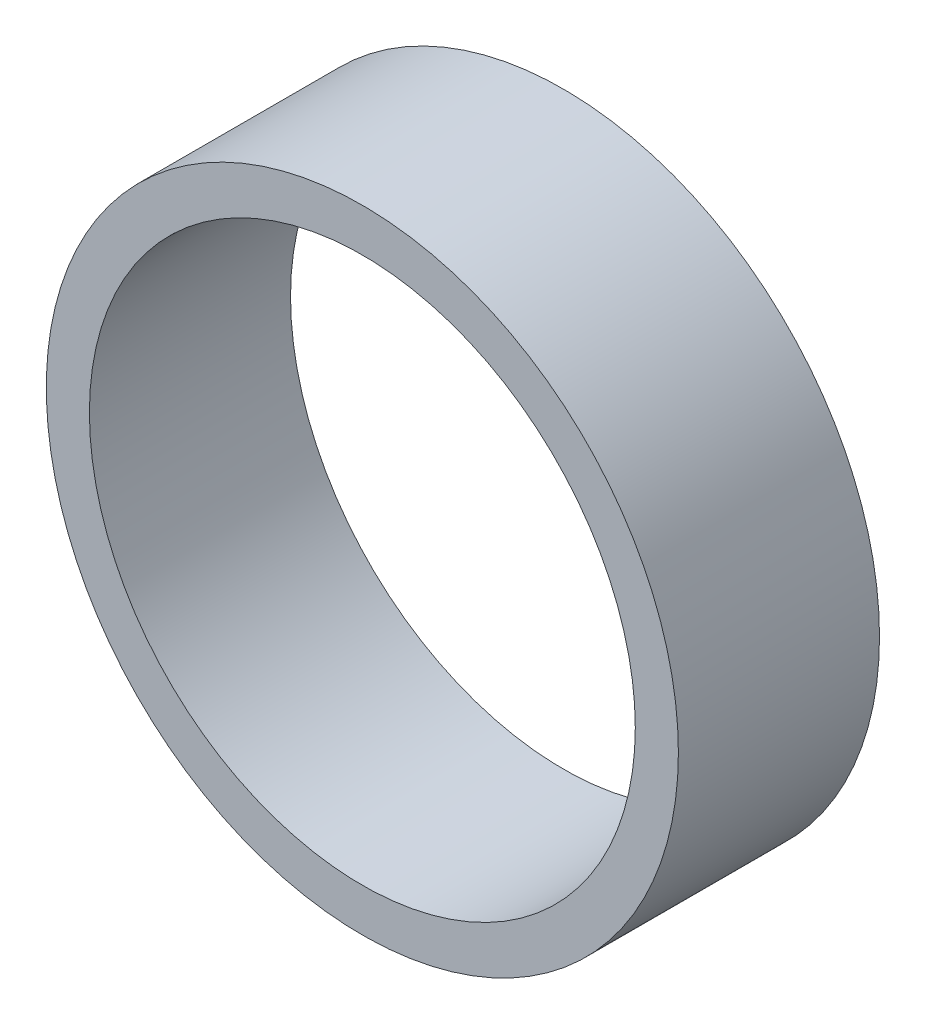
from build123d import *

# Parameters (mm, degrees)
CROQUIS1_R              = 11
CROQUIS1_R_2            = 9.5
SALIENTE_EXTRUIR1_DEPTH = 7


with BuildPart() as part:
    # Croquis1 → Saliente-Extruir1 (new body)
    with BuildSketch(Plane.XY):
        Circle(CROQUIS1_R)
        Circle(CROQUIS1_R_2, mode=Mode.SUBTRACT)
    extrude(amount=SALIENTE_EXTRUIR1_DEPTH)


solid = part.part
